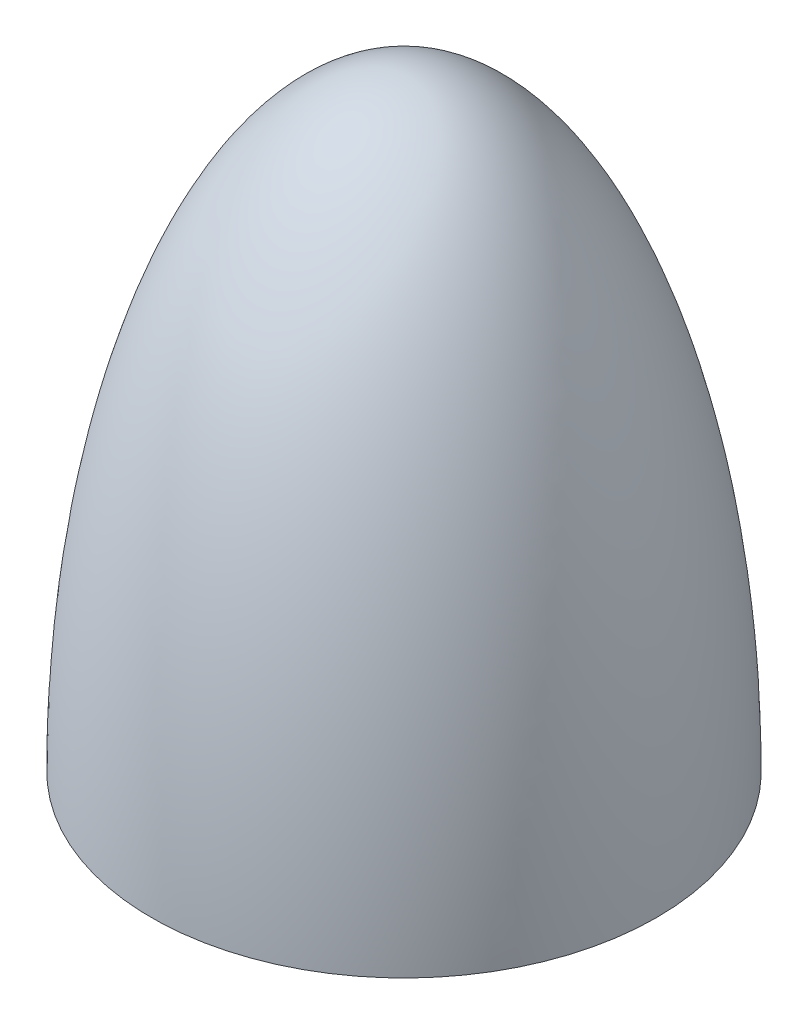
from build123d import *


with BuildPart() as part:
    # Sketch4 → Revolve7 (revolve)
    with BuildSketch(Plane.XY):
        with BuildLine():
            add(Edge.make_bspline(
                [(59.7, 0), (59.7, 144), (0, 144)],
                knots=[4.71238898, 4.71238898, 4.71238898, 6.283185307, 6.283185307, 6.283185307], degree=2, weights=[1, 0.707106781, 1]))
            Line((59.7, 0), (60.9, 0))
            add(Edge.make_bspline(
                [(60.9, 0), (60.9, 18.912979528), (57.782000786, 56.738938584), (46.665978632, 96.874257476), (34.413194207, 121.127388189), (23.867715385, 134.738684872), (12.282046601, 143.243228174), (4.094015534, 145.2), (0, 145.2)],
                knots=[4.71238898, 4.71238898, 4.71238898, 4.71238898, 5.105088062, 5.497787144, 5.694136685, 5.890486225, 6.086835766, 6.283185307, 6.283185307, 6.283185307, 6.283185307], degree=3))
            Line((0, 145.2), (0, 144))
        make_face()
    revolve(axis=Axis((0, 0, 0), (0, 1, 0)))


solid = part.part
